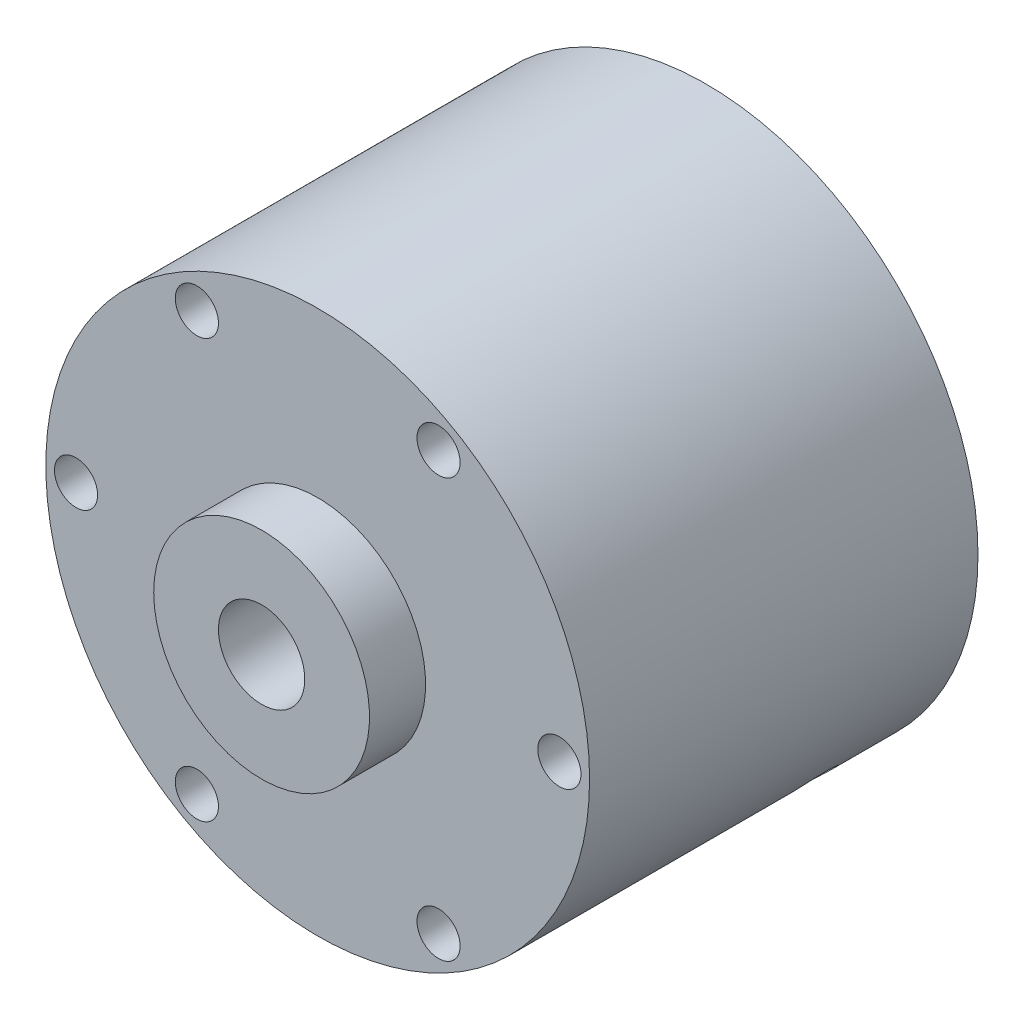
from build123d import *

# Parameters (mm, degrees)
SKETCH_2_R          = 12.5
EXTRUDE_1_DEPTH     = 1.5
SKETCH_3_R          = 31.5
EXTRUDE_2_DEPTH     = 45
SKETCH_4_R          = 12.5
EXTRUDE_3_DEPTH     = 6.5
SKETCH_5_R          = 5
CUT_EXTRUDE_1_DEPTH = 70.235106702
SKETCH_6_R          = 2.5
CUT_EXTRUDE_2_DEPTH = 70.235106702
SKETCH_7_R          = 2.5
CUT_EXTRUDE_3_DEPTH = 70.235106869
SKETCH_8_R          = 2.5
CUT_EXTRUDE_4_DEPTH = 10
SKETCH_9_R          = 2.5
CUT_EXTRUDE_5_DEPTH = 16


with BuildPart() as part:
    # 草图2 → 凸台-拉伸1 (new body)
    with BuildSketch(Plane.XY):
        Circle(SKETCH_2_R)
    extrude(amount=EXTRUDE_1_DEPTH)

    # 草图3 → 凸台-拉伸2 (add)
    with BuildSketch(Plane.XY.offset(1.5)):
        with Locations(Location((0, 0, 0), (0, 0, 180))):
            Circle(SKETCH_3_R)
    extrude(amount=EXTRUDE_2_DEPTH)

    # 草图4 → 凸台-拉伸3 (add)
    with BuildSketch(Plane.XY.offset(46.5)):
        Circle(SKETCH_4_R)
    extrude(amount=EXTRUDE_3_DEPTH)

    # 草图5 → 切除-拉伸1 (cut, through all)
    with BuildSketch(Plane.XY.offset(53)):
        Circle(SKETCH_5_R)
    extrude(amount=-CUT_EXTRUDE_1_DEPTH, mode=Mode.SUBTRACT)

    # 草图6 → 切除-拉伸2 (cut, through all)
    with BuildSketch(Plane(origin=(0, 0, 0), x_dir=(0.7071067811865477, 0.7071067811865475, 0), z_dir=(-0.7071067811865475, 0.7071067811865477, 0))):
        with Locations(Location((0, -11.5, 0), (0, 0, 180))):
            Circle(SKETCH_6_R)
    extrude(amount=-CUT_EXTRUDE_2_DEPTH, mode=Mode.SUBTRACT)

    # 草图7 → 切除-拉伸3 (cut, through all)
    with BuildSketch(Plane(origin=(0, 0, 0), x_dir=(1, 0, 0), z_dir=(0, 1, 0))):
        with Locations(Location((0, -11.5, 0), (0, 0, 270))):
            Circle(SKETCH_7_R)
    extrude(amount=-CUT_EXTRUDE_3_DEPTH, mode=Mode.SUBTRACT)

    # 草图8 → 切除-拉伸4 (cut)
    with BuildSketch(Plane.XY.offset(46.5)):
        with Locations((28, 0)):
            Circle(SKETCH_8_R)
        with Locations((-14, -24.248711306)):
            Circle(SKETCH_8_R)
        with Locations((-14, 24.248711306)):
            Circle(SKETCH_8_R)
    extrude(amount=-CUT_EXTRUDE_4_DEPTH, mode=Mode.SUBTRACT)

    # 草图9 → 切除-拉伸5 (cut)
    with BuildSketch(Plane.XY.offset(46.5)):
        with Locations((-28, 0)):
            Circle(SKETCH_9_R)
        with Locations((14, 24.248711306)):
            Circle(SKETCH_9_R)
        with Locations((14, -24.248711306)):
            Circle(SKETCH_9_R)
    extrude(amount=-CUT_EXTRUDE_5_DEPTH, mode=Mode.SUBTRACT)


solid = part.part
